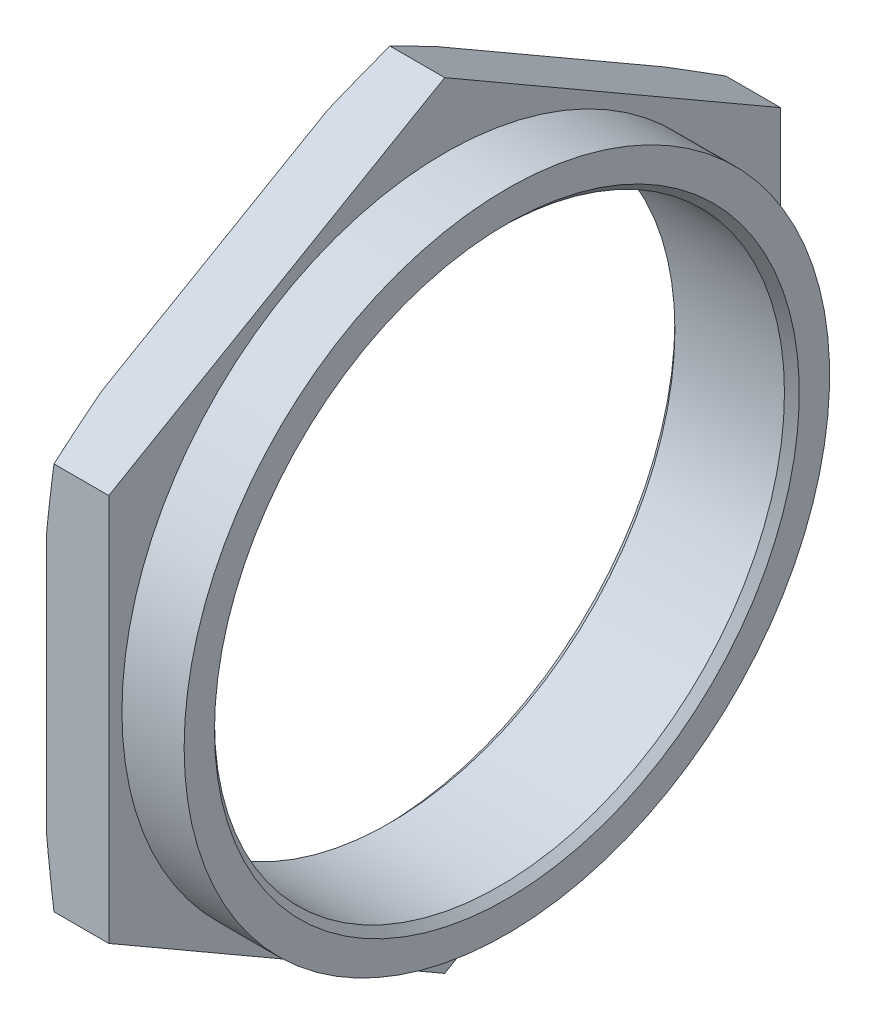
from build123d import *

# Parameters (mm, degrees)
CHAMFER1_SIZE  = 0.5
CHAMFER1_SIZE2 = 1.866025404
SKETCH2_R      = 30.350258036
EXTRUDE1_DEPTH = 38.992630864
CHAMFER2_SIZE  = 0.5


with BuildPart() as part:
    # Sketch1 → Revolve1 (revolve)
    with BuildSketch(Plane.XY, mode=Mode.PRIVATE) as revolve1_sk:
        Polygon((0, 19.25), (0, 26.2), (4.2, 26.2), (4.2, 21.8), (8.4, 21.8), (8.4, 19.25), align=None)
    revolve(revolve1_sk.sketch.rotate(Axis((0, 0, 0), (1, 0, 0)), 90), axis=Axis((0, 0, 0), (1, 0, 0)))

    # Chamfer1
    chamfer1_edges = [part.edges().sort_by_distance(p)[0] for p in [
        (0, 0, -26.2),
    ]]
    chamfer1_side = [part.faces().sort_by_distance(p)[0] for p in [
        (2.1, 0, -26.2),
    ]]
    chamfer(chamfer1_edges, length=CHAMFER1_SIZE, length2=CHAMFER1_SIZE2, reference=chamfer1_side[0])

    # Sketch2 → Extrude1 (cut, through all)
    with BuildSketch(Plane.ZY):
        Circle(SKETCH2_R)
        Polygon((0, 26.2), (-22.689865579, 13.1), (-22.689865579, -13.1), (0, -26.2), (22.689865579, -13.1), (22.689865579, 13.1), align=None, mode=Mode.SUBTRACT)
    extrude(amount=-EXTRUDE1_DEPTH, mode=Mode.SUBTRACT)

    # Chamfer2
    chamfer2_edges = [part.edges().sort_by_distance(p)[0] for p in [
        (8.4, 0, -19.25),
        (0, 0, -19.25),
    ]]
    chamfer(chamfer2_edges, length=CHAMFER2_SIZE)


solid = part.part
